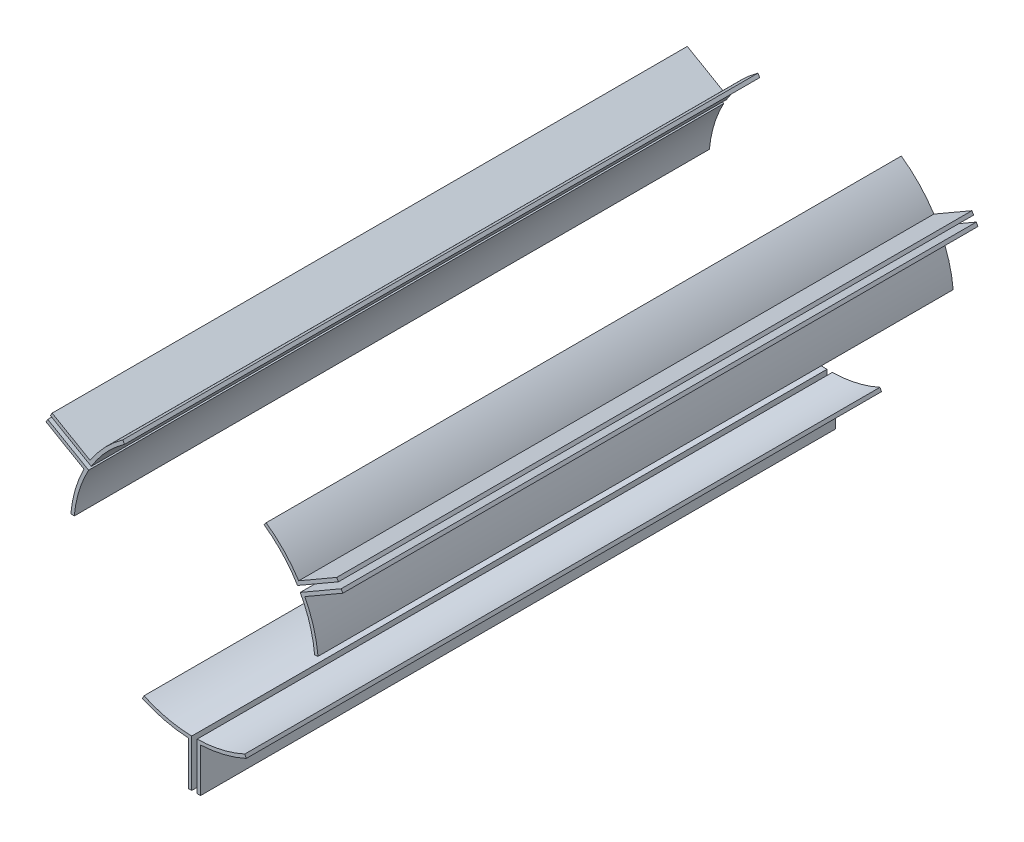
from build123d import *

# Parameters (mm, degrees)
BOSS_EXTRUDE1_DEPTH   = 222.25
BOSS_EXTRUDE1_2_DEPTH = 222.25
BOSS_EXTRUDE1_3_DEPTH = 222.25
BOSS_EXTRUDE1_4_DEPTH = 222.25
BOSS_EXTRUDE1_5_DEPTH = 222.25
BOSS_EXTRUDE1_6_DEPTH = 222.25


with BuildPart() as part:
    # Sketch1 → Boss-Extrude1 (new, symmetric)
    with BuildSketch(Plane.XY):
        with BuildLine():
            Line((-1.8796, -84.43408156), (-1.8796, -117.45408156))
            Line((-1.8796, -117.45408156), (-4.2926, -117.45408156))
            Line((-4.2926, -117.45408156), (-4.2926, -86.761875321))
            ThreePointArc((-4.2926, -86.761875321), (-20.666871058, -84.373751041), (-36.291213239, -78.923996767))
            Line((-36.291213239, -78.923996767), (-35.283123983, -76.731663523))
            ThreePointArc((-35.283123983, -76.731663523), (-18.976270033, -82.295493198), (-1.8796, -84.43408156))
        make_face()
    extrude(amount=BOSS_EXTRUDE1_DEPTH, both=True)


with BuildPart() as body_2:
    # Sketch1 → Boss-Extrude1 2 (new, symmetric)
    with BuildSketch(Plane.XY):
        with BuildLine():
            Line((1.8796, -84.43408156), (1.8796, -117.45408156))
            Line((1.8796, -117.45408156), (4.2926, -117.45408156))
            Line((4.2926, -117.45408156), (4.2926, -86.761875321))
            ThreePointArc((4.2926, -86.761875321), (20.666871058, -84.373751041), (36.291213239, -78.923996767))
            Line((36.291213239, -78.923996767), (35.283123983, -76.731663523))
            ThreePointArc((35.283123983, -76.731663523), (18.976270033, -82.295493198), (1.8796, -84.43408156))
        make_face()
    extrude(amount=BOSS_EXTRUDE1_2_DEPTH, both=True)


with BuildPart() as body_3:
    # Sketch1 → Boss-Extrude1 3 (new, symmetric)
    with BuildSketch(Plane.XY):
        with BuildLine():
            Line((-48.810007894, 68.921913455), (-50.204579548, 70.891110983))
            ThreePointArc((-50.204579548, 70.891110983), (-62.736376285, 60.084910873), (-72.991688108, 47.098438309))
            Line((-72.991688108, 47.098438309), (-99.571918409, 62.444541428))
            Line((-99.571918409, 62.444541428), (-100.778418409, 60.354822129))
            Line((-100.778418409, 60.354822129), (-72.182259576, 43.844822129))
            ThreePointArc((-72.182259576, 43.844822129), (-61.78185271, 57.581678516), (-48.810007894, 68.921913455))
        make_face()
    extrude(amount=BOSS_EXTRUDE1_3_DEPTH, both=True)


with BuildPart() as body_4:
    # Sketch1 → Boss-Extrude1 4 (new, symmetric)
    with BuildSketch(Plane.XY):
        with BuildLine():
            Line((-74.061859576, 40.589259431), (-102.658018409, 57.099259431))
            Line((-102.658018409, 57.099259431), (-103.864518409, 55.009540132))
            Line((-103.864518409, 55.009540132), (-77.284288108, 39.663437012))
            ThreePointArc((-77.284288108, 39.663437012), (-83.403247343, 24.288840168), (-86.495792788, 8.032885784))
            Line((-86.495792788, 8.032885784), (-84.093131877, 7.809750068))
            ThreePointArc((-84.093131877, 7.809750068), (-80.758122743, 24.713814681), (-74.061859576, 40.589259431))
        make_face()
    extrude(amount=BOSS_EXTRUDE1_4_DEPTH, both=True)


with BuildPart() as body_5:
    # Sketch1 → Boss-Extrude1 5 (new, symmetric)
    with BuildSketch(Plane.XY):
        with BuildLine():
            Line((84.093131877, 7.809750068), (86.495792788, 8.032885784))
            ThreePointArc((86.495792788, 8.032885784), (83.403247343, 24.288840168), (77.284288108, 39.663437012))
            Line((77.284288108, 39.663437012), (103.864518409, 55.009540132))
            Line((103.864518409, 55.009540132), (102.658018409, 57.099259431))
            Line((102.658018409, 57.099259431), (74.061859576, 40.589259431))
            ThreePointArc((74.061859576, 40.589259431), (80.758122743, 24.713814681), (84.093131877, 7.809750068))
        make_face()
    extrude(amount=BOSS_EXTRUDE1_5_DEPTH, both=True)


with BuildPart() as body_6:
    # Sketch1 → Boss-Extrude1 6 (new, symmetric)
    with BuildSketch(Plane.XY):
        with BuildLine():
            Line((72.182259576, 43.844822129), (100.778418409, 60.354822129))
            Line((100.778418409, 60.354822129), (99.571918409, 62.444541428))
            Line((99.571918409, 62.444541428), (72.991688108, 47.098438309))
            ThreePointArc((72.991688108, 47.098438309), (62.736376285, 60.084910873), (50.204579548, 70.891110983))
            Line((50.204579548, 70.891110983), (48.810007894, 68.921913455))
            ThreePointArc((48.810007894, 68.921913455), (61.78185271, 57.581678516), (72.182259576, 43.844822129))
        make_face()
    extrude(amount=BOSS_EXTRUDE1_6_DEPTH, both=True)


solid = Compound([part.part, body_2.part, body_3.part, body_4.part, body_5.part, body_6.part])
